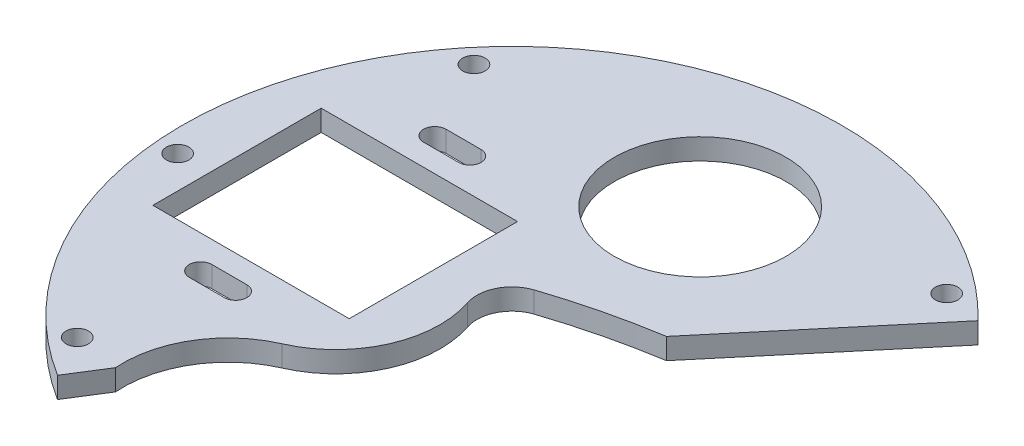
from build123d import *

# Parameters (mm, degrees)
SKETCH1_R           = 12.247413434
SKETCH1_R_2         = 1.6
BOSS_EXTRUDE1_DEPTH = 3


with BuildPart() as part:
    # Sketch1 → Boss-Extrude1 (new body)
    # profile 1 of 4: a face of its own
    with BuildSketch(Plane(origin=(0, 0, 0), x_dir=(1, 0, 0), z_dir=(0, 1, 0))):
        with BuildLine():
            ThreePointArc((-1.570198622, 4.747049219), (5.939862085, 6.896641641), (13.599748073, 8.42892949))
            Line((13.599748073, 8.42892949), (29.987808283, 27.959459121))
            Line((29.987808283, 27.959459121), (33.869799276, 32.585835834))
            ThreePointArc((33.869799276, 32.585835834), (30.211017655, 36.004088827), (26.209354845, 39.013711931))
            Line((26.209354845, 39.013711931), (22.327363852, 34.387335218))
            ThreePointArc((22.327363852, 34.387335218), (-14.018145326, 38.529100711), (-39.204591568, 12))
            Line((-39.204591568, 12), (-11.204591568, 12))
            Line((-11.204591568, 12), (-11.204591568, -12))
            Line((-11.204591568, -12), (-39.204591568, -12))
            ThreePointArc((-39.204591568, -12), (-32.558798287, -24.918359779), (-21.825227783, -34.708204106))
            ThreePointArc((-21.825227783, -34.708204106), (-19.713839088, -25.875293038), (-12.892481496, -19.879681247))
            ThreePointArc((-12.892481496, -19.879681247), (-5.276324008, -12.302707641), (-4.746257371, -1.572590527))
            ThreePointArc((-4.746257371, -1.572590527), (-4.467534634, 2.245247045), (-1.570198622, 4.747049219))
        make_face()
        with BuildLine():
            Line((-22.704591568, -18.3), (-27.704591568, -18.3))
            ThreePointArc((-27.704591568, -18.3), (-29.304591568, -16.7), (-27.704591568, -15.1))
            Line((-27.704591568, -15.1), (-22.704591568, -15.1))
            ThreePointArc((-22.704591568, -15.1), (-21.104591568, -16.7), (-22.704591568, -18.3))
        make_face(mode=Mode.SUBTRACT)
        with BuildLine():
            ThreePointArc((-27.704591568, 15.1), (-29.304591568, 16.7), (-27.704591568, 18.3))
            Line((-27.704591568, 18.3), (-22.704591568, 18.3))
            ThreePointArc((-22.704591568, 18.3), (-21.104591568, 16.7), (-22.704591568, 15.1))
            Line((-22.704591568, 15.1), (-27.704591568, 15.1))
        make_face(mode=Mode.SUBTRACT)
        with Locations(Location((0, 26.835034763, 0), (0, 0, 270))):
            Circle(SKETCH1_R, mode=Mode.SUBTRACT)
        with Locations(Location((28.282654826, 33.705955497, 0), (0, 0, 270))):
            Circle(SKETCH1_R_2, mode=Mode.SUBTRACT)
    # profile 2 of 4: a face of its own
    with BuildSketch(Plane(origin=(0, 0, 0), x_dir=(1, 0, 0), z_dir=(0, 1, 0))):
        with BuildLine():
            Line((-25.019163556, -39.787453487), (-21.825227783, -34.708204106))
            ThreePointArc((-21.825227783, -34.708204106), (-32.558798287, -24.918359779), (-39.204591568, -12))
            ThreePointArc((-39.204591568, -12), (-41, 0), (-39.204591568, 12))
            ThreePointArc((-39.204591568, 12), (-14.018145326, 38.529100711), (22.327363852, 34.387335218))
            Line((22.327363852, 34.387335218), (26.209354845, 39.013711931))
            ThreePointArc((26.209354845, 39.013711931), (-39.405076534, 25.617180629), (-25.019163556, -39.787453487))
        make_face()
        with Locations(Location((-28.282654826, -33.705955497, 0), (0, 0, 270))):
            Circle(SKETCH1_R_2, mode=Mode.SUBTRACT)
        with Locations(Location((-43.832566716, -3.834852681, 0), (0, 0, 270))):
            Circle(SKETCH1_R_2, mode=Mode.SUBTRACT)
        with Locations(Location((-33.705955497, 28.282654826, 0), (0, 0, 270))):
            Circle(SKETCH1_R_2, mode=Mode.SUBTRACT)
    # profile 3 of 4: a face of its own
    with BuildSketch(Plane(origin=(0, 0, 0), x_dir=(1, 0, 0), z_dir=(0, 1, 0))):
        with BuildLine():
            ThreePointArc((-39.204591568, 12), (-41, 0), (-39.204591568, -12))
            Line((-39.204591568, -12), (-39.204591568, 12))
        make_face()
    # profile 4 of 4: a face of its own
    with BuildSketch(Plane(origin=(0, 0, 0), x_dir=(1, 0, 0), z_dir=(0, 1, 0))):
        with BuildLine():
            ThreePointArc((-1.570198622, 4.747049219), (5.939862085, 6.896641641), (13.599748073, 8.42892949))
            Line((13.599748073, 8.42892949), (29.987808283, 27.959459121))
            Line((29.987808283, 27.959459121), (33.869799276, 32.585835834))
            ThreePointArc((33.869799276, 32.585835834), (30.211017655, 36.004088827), (26.209354845, 39.013711931))
            Line((26.209354845, 39.013711931), (22.327363852, 34.387335218))
            ThreePointArc((22.327363852, 34.387335218), (-14.018145326, 38.529100711), (-39.204591568, 12))
            Line((-39.204591568, 12), (-11.204591568, 12))
            Line((-11.204591568, 12), (-11.204591568, -12))
            Line((-11.204591568, -12), (-39.204591568, -12))
            ThreePointArc((-39.204591568, -12), (-32.558798287, -24.918359779), (-21.825227783, -34.708204106))
            ThreePointArc((-21.825227783, -34.708204106), (-19.713839088, -25.875293038), (-12.892481496, -19.879681247))
            ThreePointArc((-12.892481496, -19.879681247), (-5.276324008, -12.302707641), (-4.746257371, -1.572590527))
            ThreePointArc((-4.746257371, -1.572590527), (-4.467534634, 2.245247045), (-1.570198622, 4.747049219))
        make_face()
        with BuildLine():
            Line((-22.704591568, -18.3), (-27.704591568, -18.3))
            ThreePointArc((-27.704591568, -18.3), (-29.304591568, -16.7), (-27.704591568, -15.1))
            Line((-27.704591568, -15.1), (-22.704591568, -15.1))
            ThreePointArc((-22.704591568, -15.1), (-21.104591568, -16.7), (-22.704591568, -18.3))
        make_face(mode=Mode.SUBTRACT)
        with BuildLine():
            ThreePointArc((-27.704591568, 15.1), (-29.304591568, 16.7), (-27.704591568, 18.3))
            Line((-27.704591568, 18.3), (-22.704591568, 18.3))
            ThreePointArc((-22.704591568, 18.3), (-21.104591568, 16.7), (-22.704591568, 15.1))
            Line((-22.704591568, 15.1), (-27.704591568, 15.1))
        make_face(mode=Mode.SUBTRACT)
        with Locations(Location((0, 26.835034763, 0), (0, 0, 270))):
            Circle(SKETCH1_R, mode=Mode.SUBTRACT)
        with Locations(Location((28.282654826, 33.705955497, 0), (0, 0, 270))):
            Circle(SKETCH1_R_2, mode=Mode.SUBTRACT)
    extrude(amount=BOSS_EXTRUDE1_DEPTH)


solid = part.part
